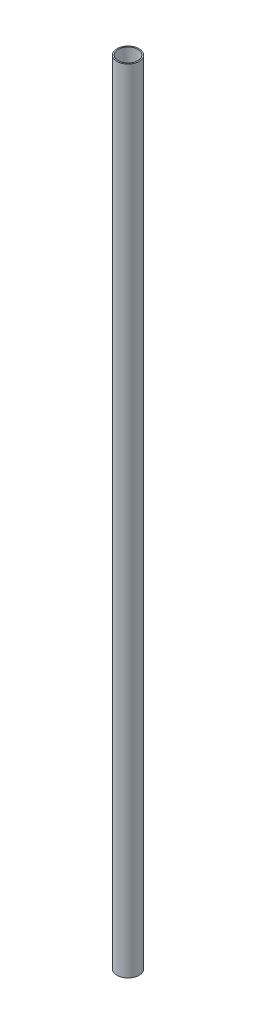
from build123d import *

# Parameters (mm, degrees)
SCHIZZO1_R                   = 9
SCHIZZO1_R_2                 = 8
ESTRUSIONE_ESTRUSIONE1_DEPTH = 645


with BuildPart() as part:
    # Schizzo1 → Estrusione-Estrusione1 (new body)
    with BuildSketch(Plane(origin=(0, 0, 0), x_dir=(1, 0, 0), z_dir=(0, 1, 0))):
        with Locations(Location((0, 0, 0), (0, 0, 90))):
            Circle(SCHIZZO1_R)
        with Locations(Location((0, 0, 0), (0, 0, 90))):
            Circle(SCHIZZO1_R_2, mode=Mode.SUBTRACT)
    extrude(amount=ESTRUSIONE_ESTRUSIONE1_DEPTH)


solid = part.part
